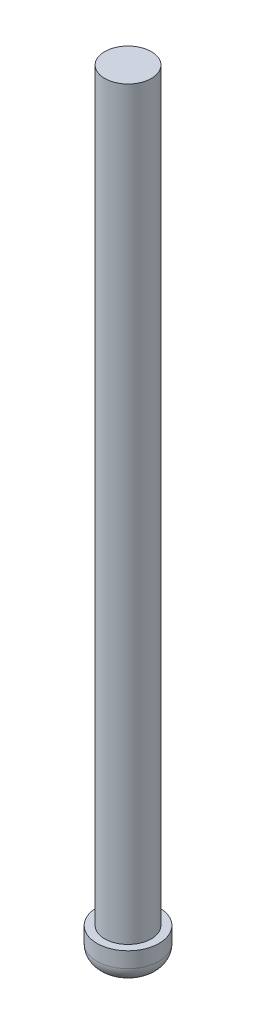
from build123d import *

# Parameters (mm, degrees)
CROQUIS1_R              = 0.75
SALIENTE_EXTRUIR1_DEPTH = 24
CROQUIS2_R              = 1
SALIENTE_EXTRUIR2_DEPTH = 1
REDONDEO1_R             = 0.5


with BuildPart() as part:
    # Croquis1 → Saliente-Extruir1 (new body)
    with BuildSketch(Plane(origin=(0, 0, 0), x_dir=(1, 0, 0), z_dir=(0, 1, 0))):
        with Locations(Location((0, 0, 0), (0, 0, 270))):
            Circle(CROQUIS1_R)
    extrude(amount=SALIENTE_EXTRUIR1_DEPTH)

    # Croquis2 → Saliente-Extruir2 (add)
    with BuildSketch(Plane.XZ):
        with Locations(Location((0, 0, 0), (0, 0, 270))):
            Circle(CROQUIS2_R)
    extrude(amount=SALIENTE_EXTRUIR2_DEPTH)

    # Redondeo1
    redondeo1_edges = [part.edges().sort_by_distance(p)[0] for p in [
        (0, -1, 1),
    ]]
    fillet(redondeo1_edges, radius=REDONDEO1_R)


solid = part.part
